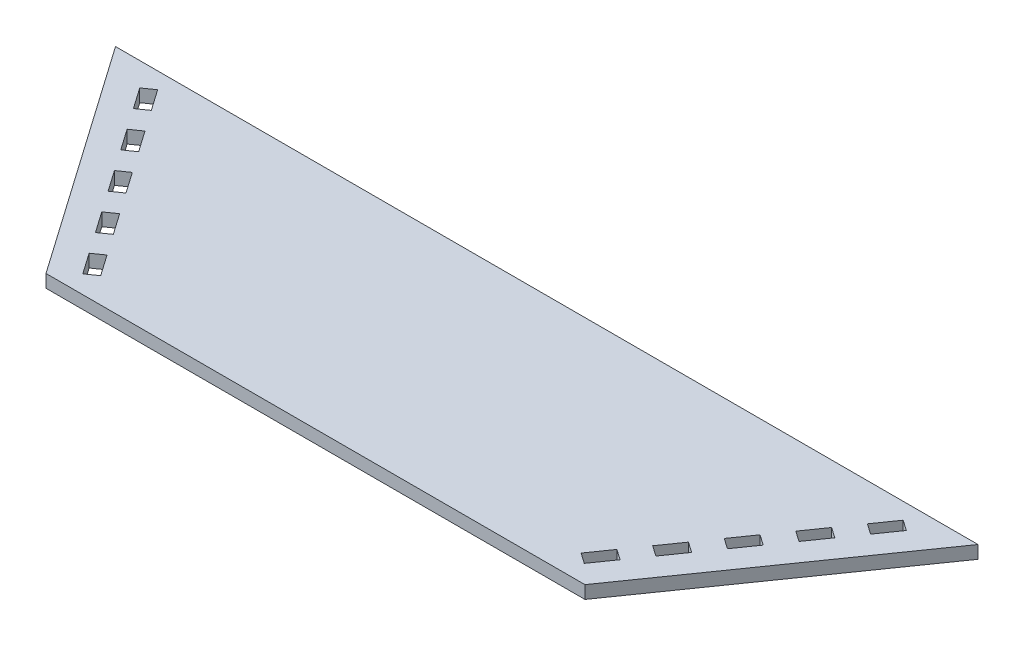
from build123d import *

# Parameters (mm, degrees)
BOSS_EXTRUDE1_DEPTH = 3.175


with BuildPart() as part:
    # Sketch1 → Boss-Extrude1 (new body)
    with BuildSketch(Plane(origin=(0, 0, 0), x_dir=(1, 0, 0), z_dir=(0, 1, 0))):
        Polygon((-39.972456053, 57.15), (173.151878886, 57.15), (133.179422833, 0), (0, 0), align=None)
        Polygon((-18.245720617, 42.70524807), (-14.606223674, 37.50173368), (-17.207980869, 35.681985209), (-20.847477812, 40.885499598), align=None, mode=Mode.SUBTRACT)
        Polygon((-10.966726732, 32.29821929), (-13.568483927, 30.478470819), (-9.928986984, 25.274956429), (-7.327229789, 27.0947049), align=None, mode=Mode.SUBTRACT)
        Polygon((-0.048235904, 16.687676121), (-2.649993099, 14.867927649), (-6.289490041, 20.071442039), (-3.687732847, 21.89119051), align=None, mode=Mode.SUBTRACT)
        Polygon((3.591261039, 11.484161731), (0.989503844, 9.66441326), (4.629000786, 4.46089887), (7.230757981, 6.280647341), align=None, mode=Mode.SUBTRACT)
        Polygon((155.064640392, 47.908762459), (157.666397587, 46.089013988), (161.30589453, 51.292528378), (158.704137335, 53.112276849), align=None, mode=Mode.SUBTRACT)
        Polygon((125.948664851, 6.280647341), (129.588161794, 11.484161731), (132.189918989, 9.66441326), (128.550422046, 4.46089887), align=None, mode=Mode.SUBTRACT)
        Polygon((139.468912874, 20.071442039), (135.829415932, 14.867927649), (133.227658737, 16.687676121), (136.867155679, 21.89119051), align=None, mode=Mode.SUBTRACT)
        Polygon((140.506652622, 27.0947049), (144.146149564, 32.29821929), (146.747906759, 30.478470819), (143.108409817, 25.274956429), align=None, mode=Mode.SUBTRACT)
        Polygon((-25.524714502, 53.112276849), (-21.88521756, 47.908762459), (-24.486974754, 46.089013988), (-28.126471697, 51.292528378), align=None, mode=Mode.SUBTRACT)
        Polygon((147.785646507, 37.50173368), (150.387403702, 35.681985209), (154.026900645, 40.885499598), (151.42514345, 42.70524807), align=None, mode=Mode.SUBTRACT)
    extrude(amount=BOSS_EXTRUDE1_DEPTH)


solid = part.part
